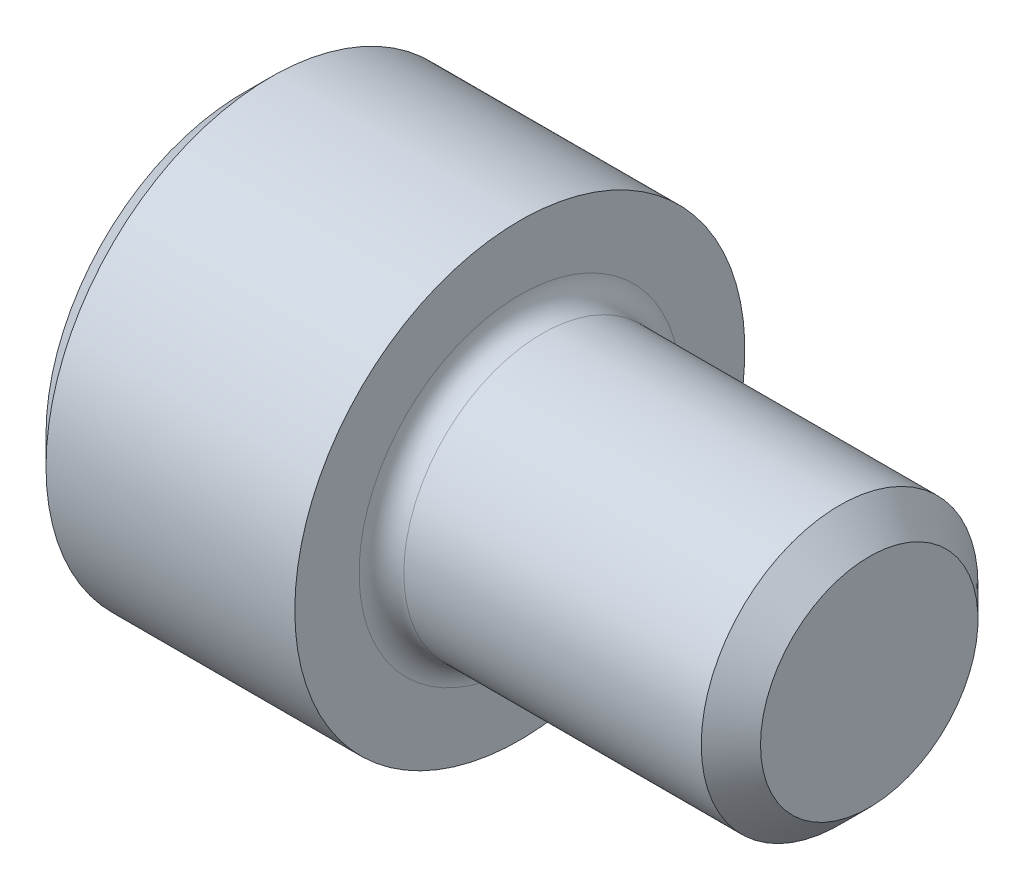
from build123d import *

# Parameters (mm, degrees)
FILLET1_R   = 0.2032
HEX_2_DEPTH = 1.1176


with BuildPart() as part:
    # BodySke → Base-Revolve (revolve)
    with BuildSketch(Plane.XY, mode=Mode.PRIVATE) as base_revolve_sk:
        Polygon((0, 0), (0, 1.7907), (0.254, 2.0447), (2.5146, 2.0447), (2.5146, 1.2573), (5.42036, 1.2573), (5.6896, 0.98806), (5.6896, 0), align=None)
    revolve(base_revolve_sk.sketch.rotate(Axis((-31.75, 0, 0), (1, 0, 0)), 90), axis=Axis((-31.75, 0, 0), (1, 0, 0)))

    # Fillet1
    fillet1_edges = [part.edges().sort_by_distance(p)[0] for p in [
        (2.5146, 0, -1.2573),
    ]]
    fillet(fillet1_edges, radius=FILLET1_R)

    # Sketch2 → Hex-PreBroach (revolve, cut)
    with BuildSketch(Plane.XY, mode=Mode.PRIVATE) as hex_prebroach_sk:
        Polygon((0, 0.9906), (1.1176, 0.9906), (1.689523177, 0), (0, 0), align=None)
    revolve(hex_prebroach_sk.sketch.rotate(Axis((0, 0, 0), (1, 0, 0)), 90), axis=Axis((0, 0, 0), (1, 0, 0)), mode=Mode.SUBTRACT)

    # Sketch3 → Hex 2 (cut)
    with BuildSketch(Plane(origin=(0, 0, 0), x_dir=(0, 0.500000000000001, 0.866025403784438), z_dir=(-1, 0, 0))):
        Polygon((0.571923177, 0.9906), (-0.571923177, 0.9906), (-1.143846353, 0), (-0.571923177, -0.9906), (0.571923177, -0.9906), (1.143846353, 0), align=None)
    extrude(amount=-HEX_2_DEPTH, mode=Mode.SUBTRACT)


solid = part.part
